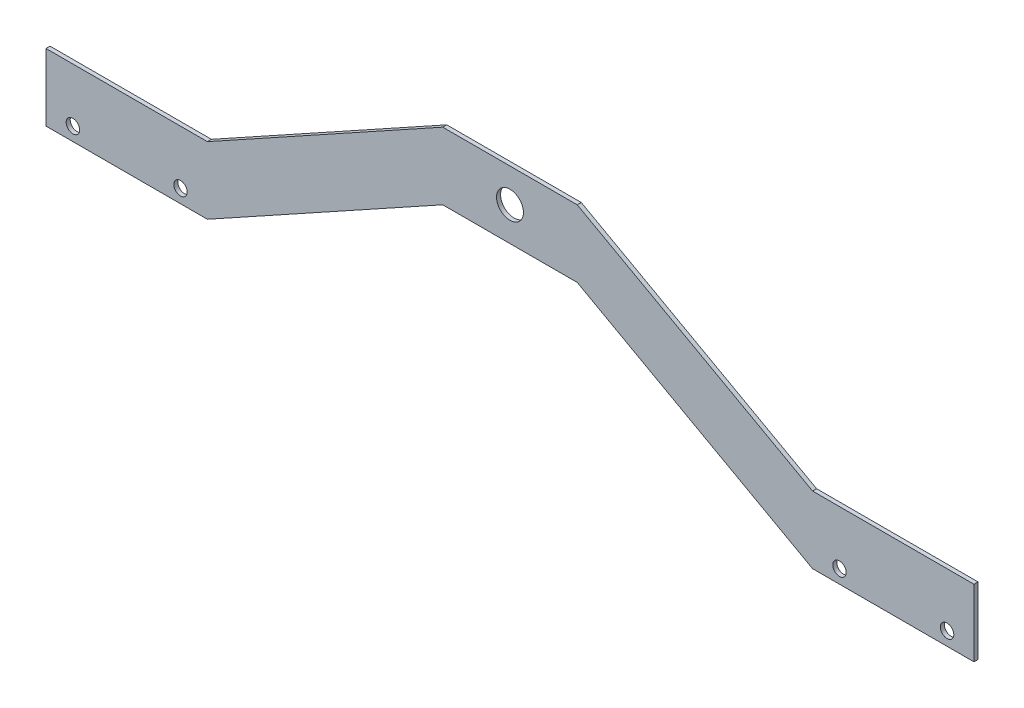
from build123d import *

# Parameters (mm, degrees)
SKETCH1_W           = 120
SKETCH1_H           = 50
BOSS_EXTRUDE1_DEPTH = 3
SKETCH2_R           = 5
SKETCH2_R_2         = 10
CUT_EXTRUDE1_DEPTH  = 531.57368012


with BuildPart() as part:
    # Sketch1 → Boss-Extrude1 (new body)
    with BuildSketch(Plane.XY):
        with Locations((122.368410373, 32.479010759)):
            Rectangle(SKETCH1_W, SKETCH1_H)
        Polygon((-387.631589627, 7.479010759), (-387.631589627, 57.479010759), (-212.631589627, 154.303594414), (-112.631589627, 154.303594414), (62.368410373, 57.479010759), (62.368410373, 7.479010759), (-112.631589627, 104.303594414), (-212.631589627, 104.303594414), align=None)
        with Locations((-447.631589627, 32.479010759)):
            Rectangle(SKETCH1_W, SKETCH1_H)
    extrude(amount=BOSS_EXTRUDE1_DEPTH)

    # Sketch2 → Cut-Extrude1 (cut, through all)
    with BuildSketch(Plane.XY.offset(3)):
        with Locations((-487.631589627, 17.479010759)):
            Circle(SKETCH2_R)
        with Locations((-407.631589627, 17.479010759)):
            Circle(SKETCH2_R)
        with Locations(Location((82.368410373, 17.479010759, 0), (0, 0, 180))):
            Circle(SKETCH2_R)
        with Locations(Location((162.368410373, 17.479010759, 0), (0, 0, 180))):
            Circle(SKETCH2_R)
        with Locations((-162.631589627, 129.303594414)):
            Circle(SKETCH2_R_2)
    extrude(amount=-CUT_EXTRUDE1_DEPTH, mode=Mode.SUBTRACT)


solid = part.part
